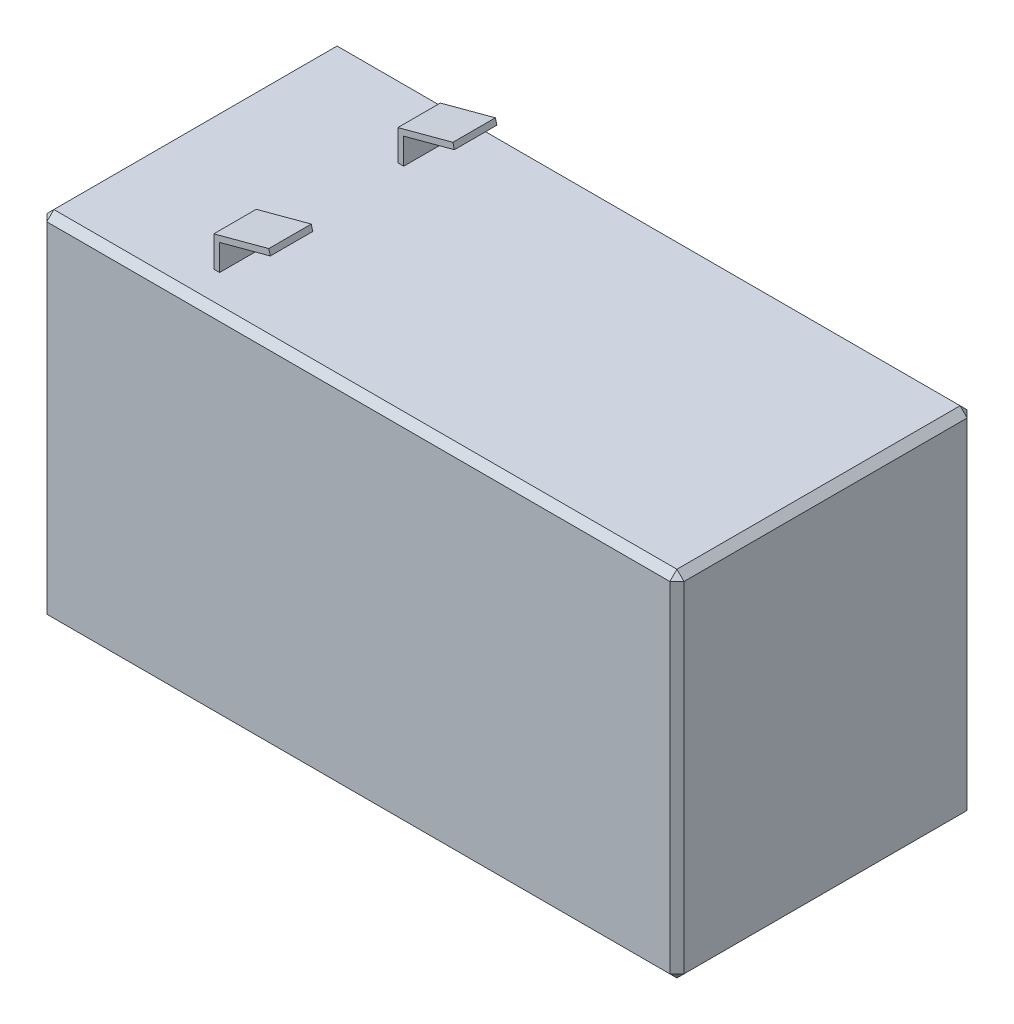
from build123d import *

# Parameters (mm, degrees)
ESQUISSE2_W        = 90
ESQUISSE2_H        = 42
BOSS_EXTRU_1_DEPTH = 50
CHANFREIN1_SIZE    = 1
EXTRU_MINCE1_DEPTH = 3


with BuildPart() as part:
    # Esquisse2 → Boss.-Extru.1 (new body)
    with BuildSketch(Plane(origin=(0, 0, 0), x_dir=(1, 0, 0), z_dir=(0, 1, 0))):
        Rectangle(ESQUISSE2_W, ESQUISSE2_H)
    extrude(amount=BOSS_EXTRU_1_DEPTH)

    # Chanfrein1
    chanfrein1_edges = [part.edges().sort_by_distance(p)[0] for p in [
        (-45, 50, 0),
        (0, 50, 21),
        (45, 50, 0),
        (0, 0, 21),
        (-45, 0, 0),
        (0, 0, -21),
        (45, 0, 0),
        (45, 25, 21),
        (-45, 25, 21),
        (-45, 25, -21),
        (45, 25, -21),
        (0, 50, -21),
    ]]
    chamfer(chanfrein1_edges, length=CHANFREIN1_SIZE)

    # Esquisse5 → Extru.-Mince1 (add, symmetric)
    with BuildSketch(Plane.XY.offset(13)):
        Polygon((-24.585, 50), (-24.585, 53.6815593), (-17.428488481, 55.599140782), (-17.643308289, 56.400859218), (-25.415, 54.3184407), (-25.415, 50), align=None)
    extru_mince1 = extrude(amount=EXTRU_MINCE1_DEPTH, both=True)

    # Symétrie1: Extru.-Mince1 across plane
    add(extru_mince1.mirror(Plane.XY))


solid = part.part
